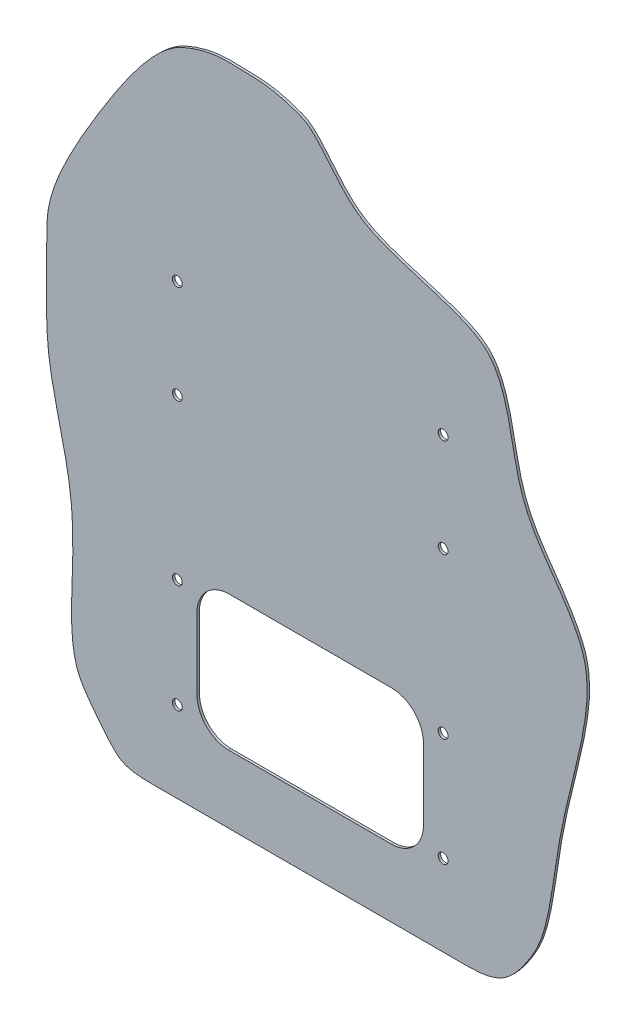
from build123d import *

# Parameters (mm, degrees)
AUFSATZ_LINEAR_AUSTRAGEN1_DEPTH      = 1
SCHNITT_LINEAR_AUSTRAGEN4_DEPTH      = 178.279264724
SCHNITT_LINEAR_AUSTRAGEN4_DEPTH_BACK = 178.279264724
SKIZZE2_R                            = 2
SCHNITT_LINEAR_AUSTRAGEN6_DEPTH      = 178.279264724


with BuildPart() as part:
    # Skizze1 → Aufsatz-Linear austragen1 (new body)
    with BuildSketch(Plane.XY):
        with BuildLine():
            Line((-63.938151944, -137), (63.938151944, -137))
            add(Edge.make_bspline(
                [(-63.938151944, -137), (-64.268938192, -137), (-64.941916449, -136.996829184), (-66.196534836, -136.9776294), (-67.65833175, -136.929307352), (-69.226815722, -136.832724532), (-71.085433613, -136.654933731), (-72.98595518, -136.348320567), (-74.693639461, -135.882975891), (-76.022362465, -135.338527521), (-77.235592363, -134.649971025), (-78.563165157, -133.664481159), (-80.12962877, -132.222433205), (-81.977274042, -130.227388829), (-84.13584453, -127.63397464), (-86.603153748, -124.461292626), (-89.047795785, -121.255856576), (-90.856822147, -118.757549112), (-92.09290748, -116.903448032), (-93.169576784, -115.078375567), (-94.020793275, -113.366413976), (-94.738302469, -111.549686334), (-95.563561355, -108.882094196), (-96.329910326, -105.111606693), (-96.845794337, -99.910310023), (-97.012622869, -94.121547458), (-96.925047503, -87.835168612), (-96.702226981, -81.132773735), (-96.478301521, -74.084937154), (-96.402752898, -66.744082429), (-96.62147137, -59.181466733), (-97.586689217, -48.762099554), (-100.032991635, -36.3591744), (-102.881167686, -24.692549631), (-104.824073558, -15.772236147), (-105.986228227, -9.290294941), (-106.715278533, -3.035469614), (-107.084404975, 3.483576605), (-107.195958334, 10.304423092), (-107.158040619, 16.318285105), (-107.105363452, 21.356143349), (-107.07092055, 25.25906412), (-107.051695628, 29.279373232), (-107.082731021, 33.476893033), (-107.084563892, 37.349488411), (-106.900445591, 40.981585845), (-106.424480002, 44.65132546), (-105.218780866, 50.112058037), (-102.785854091, 57.062428617), (-98.404223916, 66.353452214), (-93.992701571, 74.647061476), (-89.258382918, 82.805860281), (-84.764955909, 90.163314111), (-81.028631169, 96.126659384), (-77.024407189, 102.249465581), (-72.791801151, 108.300576652), (-68.4004027, 114.025294202), (-63.937117036, 119.164666504), (-60.262660296, 122.737681578), (-57.443480353, 125.04730014), (-55.429321937, 126.476482771), (-53.526271713, 127.600943771), (-51.496558438, 128.600536683), (-49.402567894, 129.472724327), (-46.573076615, 130.506138545), (-43.412232193, 131.433192146), (-40.004212386, 132.125124578), (-36.884991622, 132.495874282), (-33.909049358, 132.636562354), (-30.939561358, 132.618671738), (-28.38046573, 132.52899814), (-26.204761365, 132.459996314), (-24.16086924, 132.403834721), (-21.789910119, 132.3212757), (-19.083306272, 132.131076919), (-16.290296982, 131.780758509), (-13.695736767, 131.283793135), (-11.358126179, 130.710510077), (-9.450588725, 130.178038782), (-7.72301768, 129.639000867), (-6.23360104, 129.139762588), (-4.835875411, 128.642198894), (-3.57694756, 128.127847015), (-2.490314643, 127.588371028), (-1.801816295, 127.19552464), (-1.099602275, 126.731405695), (-0.08529709, 125.97249515), (1.285026268, 124.777736465), (3.057368392, 122.977535769), (5.550485737, 120.172063642), (8.213324764, 116.899434802), (11.121544125, 113.434319245), (13.476310203, 110.802828182), (15.644134367, 108.634175276), (17.545648648, 106.958214453), (19.087047902, 105.732062628), (20.693045497, 104.60350806), (22.813531939, 103.281342456), (25.424523934, 101.912848285), (28.38330116, 100.622585148), (32.07146896, 99.177355112), (36.765682082, 97.54454321), (42.322914538, 95.815422281), (47.753619802, 94.199621234), (52.953219257, 92.618196526), (57.819145287, 91.000258911), (62.236491134, 89.294863437), (66.089938345, 87.474132757), (68.740967056, 85.869408552), (70.508369693, 84.543278556), (71.642170437, 83.548756175), (72.674345921, 82.478101573), (73.981889614, 80.888806569), (75.481400294, 78.600904877), (77.082324624, 75.357901383), (78.947180969, 70.441675825), (80.796615318, 63.391717346), (82.572348399, 54.231013887), (83.984964321, 47.301379349), (85.22268487, 42.758693925), (86.16178922, 39.745121331), (88.031021386, 34.823832251), (91.261213007, 28.664929484), (95.527901665, 22.306823263), (99.181104002, 17.200091714), (102.203812988, 12.740877857), (104.526541321, 9.10196909), (106.970773275, 4.984583859), (108.817764705, 1.455144615), (110.031407026, -1.333586648), (110.766535528, -3.335827953), (111.354909746, -5.362490958), (112.290008308, -9.589005934), (112.784223855, -16.569298474), (111.707895243, -27.3265306), (109.289149668, -39.252282784), (106.105917367, -52.116819825), (103.363084972, -63.438660263), (101.459759348, -72.895076379), (99.900523279, -82.276376939), (98.622203411, -91.230973064), (97.221358155, -99.470408448), (96.027805644, -105.191931743), (94.859707189, -109.494910463), (93.799460735, -112.615691365), (92.945709549, -114.772924501), (92.008451175, -116.792581461), (90.94725065, -118.804125759), (89.806644306, -120.758443284), (88.597061231, -122.676406676), (87.393371106, -124.478719627), (85.846051631, -126.650647577), (83.993021622, -128.976599366), (81.898701742, -131.178667006), (79.24181361, -133.43351396), (76.681548127, -134.900946276), (73.649556584, -135.952655042), (71.42106241, -136.44336712), (69.384568426, -136.727828832), (67.722485048, -136.883476011), (66.215774531, -136.96270397), (64.942803997, -136.994642024), (64.270021975, -137), (63.938151944, -137)],
                knots=[0, 0, 0, 0, 0.00390625, 0.0078125, 0.015625, 0.0234375, 0.03125, 0.046875, 0.0625, 0.078125, 0.09375, 0.109375, 0.125, 0.140625, 0.15625, 0.171875, 0.1875, 0.1953125, 0.203125, 0.2109375, 0.21875, 0.2265625, 0.234375, 0.25, 0.265625, 0.28125, 0.296875, 0.3125, 0.328125, 0.34375, 0.359375, 0.375, 0.40625, 0.4375, 0.453125, 0.46875, 0.484375, 0.5, 0.515625, 0.53125, 0.5390625, 0.546875, 0.5546875, 0.5625, 0.5703125, 0.578125, 0.5859375, 0.59375, 0.609375, 0.6171875, 0.625, 0.6328125, 0.63671875, 0.640625, 0.64453125, 0.6484375, 0.65234375, 0.65625, 0.66015625, 0.662109375, 0.6640625, 0.666015625, 0.66796875, 0.669921875, 0.671875, 0.67578125, 0.6796875, 0.68359375, 0.6875, 0.69140625, 0.6953125, 0.697265625, 0.69921875, 0.703125, 0.70703125, 0.7109375, 0.71484375, 0.716796875, 0.71875, 0.720703125, 0.721679688, 0.72265625, 0.724609375, 0.725585938, 0.7265625, 0.727539062, 0.728515625, 0.73046875, 0.732421875, 0.734375, 0.73828125, 0.740234375, 0.7421875, 0.744140625, 0.745117188, 0.74609375, 0.747070312, 0.748046875, 0.75, 0.751953125, 0.75390625, 0.7578125, 0.76171875, 0.765625, 0.76953125, 0.7734375, 0.77734375, 0.78125, 0.78515625, 0.787109375, 0.7890625, 0.791015625, 0.79296875, 0.796875, 0.80078125, 0.8046875, 0.8125, 0.8203125, 0.828125, 0.830078125, 0.83203125, 0.8359375, 0.84375, 0.8515625, 0.859375, 0.86328125, 0.8671875, 0.87109375, 0.875, 0.876953125, 0.87890625, 0.880859375, 0.8828125, 0.890625, 0.8984375, 0.90625, 0.9140625, 0.921875, 0.92578125, 0.9296875, 0.9375, 0.94140625, 0.9453125, 0.94921875, 0.951171875, 0.953125, 0.955078125, 0.95703125, 0.958984375, 0.9609375, 0.962890625, 0.96484375, 0.96875, 0.97265625, 0.9765625, 0.984375, 0.98828125, 0.9921875, 0.994140625, 0.99609375, 0.998046875, 0.999023438, 1, 1, 1, 1], degree=3))
        make_face()
    extrude(amount=AUFSATZ_LINEAR_AUSTRAGEN1_DEPTH)

    # Skizze2 → Schnitt-Linear austragen4 (cut, two sides: drawn at the far end of the back side and taken through both)
    with BuildSketch(Plane.XY.offset(-SCHNITT_LINEAR_AUSTRAGEN4_DEPTH_BACK)):
        with Locations((-54, 45)):
            Circle(SKIZZE2_R)
        with Locations((-54, 5)):
            Circle(SKIZZE2_R)
        with Locations((54, 45)):
            Circle(SKIZZE2_R)
        with Locations((54, 5)):
            Circle(SKIZZE2_R)
        with Locations((54, -60)):
            Circle(SKIZZE2_R)
        with Locations((54, -104)):
            Circle(SKIZZE2_R)
        with Locations((-54, -104)):
            Circle(SKIZZE2_R)
        with Locations((-54, -60)):
            Circle(SKIZZE2_R)
    extrude(amount=SCHNITT_LINEAR_AUSTRAGEN4_DEPTH + SCHNITT_LINEAR_AUSTRAGEN4_DEPTH_BACK, mode=Mode.SUBTRACT)

    # Skizze3 → Schnitt-Linear austragen6 (cut, through all)
    with BuildSketch(Plane(origin=(0, 0, 0), x_dir=(-1, 0, 0), z_dir=(0, 0, -1))):
        with BuildLine():
            Line((33, -54.5), (-33, -54.5))
            ThreePointArc((-33, -54.5), (-42.192388155, -58.307611845), (-46, -67.5))
            Line((-46, -67.5), (-46, -96.5))
            ThreePointArc((-46, -96.5), (-42.192388155, -105.692388155), (-33, -109.5))
            Line((-33, -109.5), (33, -109.5))
            ThreePointArc((33, -109.5), (42.192388155, -105.692388155), (46, -96.5))
            Line((46, -96.5), (46, -67.5))
            ThreePointArc((46, -67.5), (42.192388155, -58.307611845), (33, -54.5))
        make_face()
    extrude(amount=-SCHNITT_LINEAR_AUSTRAGEN6_DEPTH, mode=Mode.SUBTRACT)


solid = part.part
